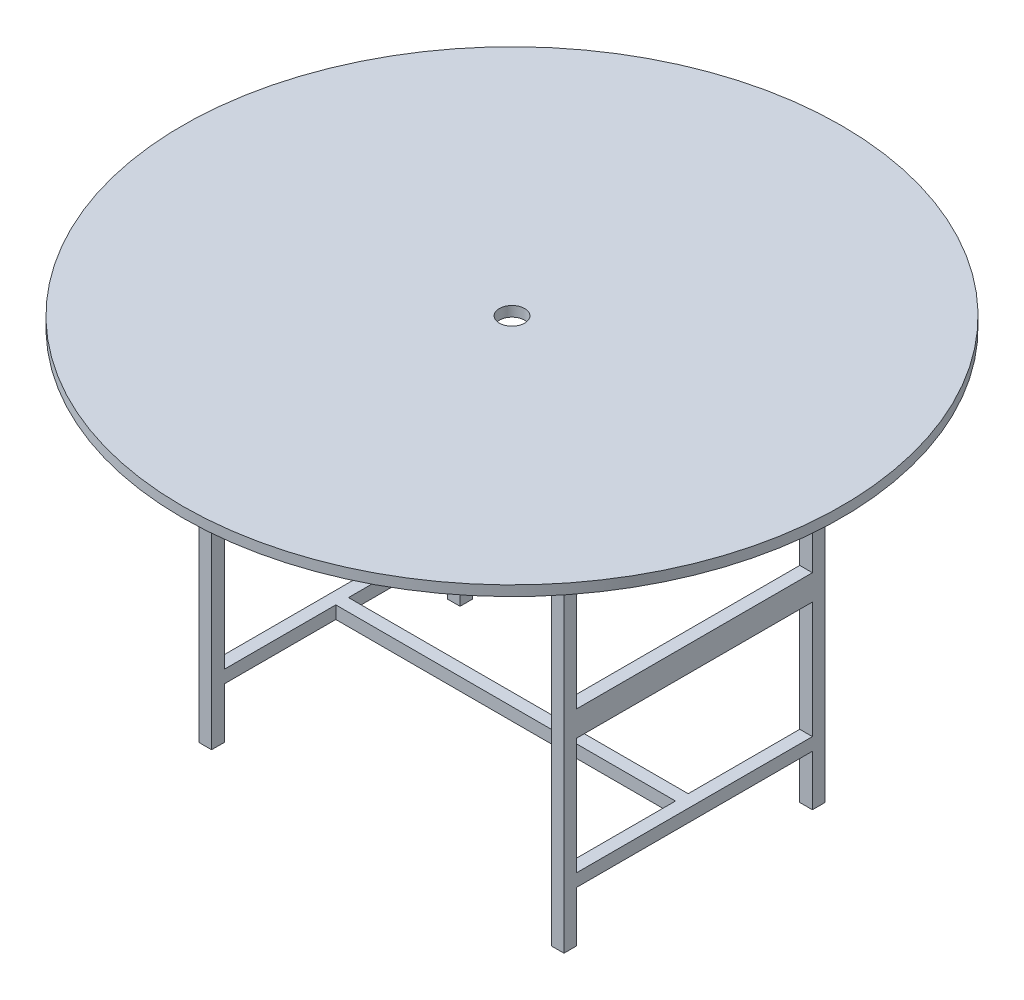
from build123d import *

# Parameters (mm, degrees)
SKETCH2_W             = 25
SKETCH2_H             = 25
BOSS_EXTRUDE1_DEPTH   = 760
BOSS_EXTRUDE1_2_DEPTH = 760
BOSS_EXTRUDE1_3_DEPTH = 760
BOSS_EXTRUDE1_4_DEPTH = 760
SKETCH3_W             = 25
SKETCH3_H             = 25
BOSS_EXTRUDE2_DEPTH   = 470
SKETCH6_W             = 25
SKETCH6_H             = 25
BOSS_EXTRUDE4_DEPTH   = 675
SKETCH10_W            = 25
SKETCH10_H            = 25
BOSS_EXTRUDE5_DEPTH   = 470
SKETCH11_W            = 25
SKETCH11_H            = 50
BOSS_EXTRUDE6_DEPTH   = 470
SKETCH12_R            = 650
BOSS_EXTRUDE7_DEPTH   = 20
SKETCH13_R            = 25
CUT_EXTRUDE3_DEPTH    = 20


with BuildPart() as part:
    # Sketch2 → Boss-Extrude1 (new body)
    with BuildSketch(Plane(origin=(0, 0, 0), x_dir=(1, 0, 0), z_dir=(0, 1, 0))):
        with Locations((-66.268467475, 428.678343046)):
            Rectangle(SKETCH2_W, SKETCH2_H)
    extrude(amount=-BOSS_EXTRUDE1_DEPTH)



with BuildPart() as body_2:
    # Sketch2 → Boss-Extrude1 2 (new body)
    with BuildSketch(Plane(origin=(0, 0, 0), x_dir=(1, 0, 0), z_dir=(0, 1, 0))):
        with Locations((628.731532525, 428.678343046)):
            Rectangle(SKETCH2_W, SKETCH2_H)
    extrude(amount=-BOSS_EXTRUDE1_2_DEPTH)


with BuildPart() as body_3:
    # Sketch2 → Boss-Extrude1 3 (new body)
    with BuildSketch(Plane(origin=(0, 0, 0), x_dir=(1, 0, 0), z_dir=(0, 1, 0))):
        with Locations((628.731532525, -61.321656954)):
            Rectangle(SKETCH2_W, SKETCH2_H)
    extrude(amount=-BOSS_EXTRUDE1_3_DEPTH)


with BuildPart() as body_4:
    # Sketch2 → Boss-Extrude1 4 (new body)
    with BuildSketch(Plane(origin=(0, 0, 0), x_dir=(1, 0, 0), z_dir=(0, 1, 0))):
        with Locations((-66.268467475, -61.321656954)):
            Rectangle(SKETCH2_W, SKETCH2_H)
    extrude(amount=-BOSS_EXTRUDE1_4_DEPTH)


with BuildPart() as part_1:
    add(part.part)

    add(body_2.part)  # Boss-Extrude2 merges body 2

    add(body_3.part)  # Boss-Extrude2 merges body 3

    add(body_4.part)  # Boss-Extrude2 merges body 4
    # Sketch3 → Boss-Extrude2 (add)
    with BuildSketch(Plane.XY.offset(-416.178343046)):
        with Locations((-66.268467475, -647.5)):
            Rectangle(SKETCH3_W, SKETCH3_H)
        with Locations((628.731532525, -647.5)):
            Rectangle(SKETCH3_W, SKETCH3_H)
    extrude(amount=BOSS_EXTRUDE2_DEPTH)

    # Sketch6 → Boss-Extrude4 (add)
    with BuildSketch(Plane(origin=(-53.768467475, 0, 0), x_dir=(0, 0, -1), z_dir=(1, 0, 0))):
        with Locations((428.678343046, -112.5)):
            Rectangle(SKETCH6_W, SKETCH6_H)
        with Locations((183.678343046, -647.5)):
            Rectangle(SKETCH6_W, SKETCH6_H)
        with Locations((-61.321656954, -112.5)):
            Rectangle(SKETCH6_W, SKETCH6_H)
    extrude(amount=BOSS_EXTRUDE4_DEPTH)

    # Sketch10 → Boss-Extrude5 (add)
    with BuildSketch(Plane(origin=(0, 0, 48.821656954), x_dir=(-1, 0, 0), z_dir=(0, 0, -1))):
        with Locations((-628.731532525, -112.5)):
            Rectangle(SKETCH10_W, SKETCH10_H)
        with Locations((66.268467475, -112.5)):
            Rectangle(SKETCH10_W, SKETCH10_H)
    extrude(amount=BOSS_EXTRUDE5_DEPTH)

    # Sketch11 → Boss-Extrude6 (add)
    with BuildSketch(Plane(origin=(0, 0, 48.821656954), x_dir=(-1, 0, 0), z_dir=(0, 0, -1))):
        with Locations((-628.731532525, -380.100970917)):
            Rectangle(SKETCH11_W, SKETCH11_H)
    extrude(amount=BOSS_EXTRUDE6_DEPTH)

    # Sketch12 → Boss-Extrude7 (add)
    with BuildSketch(Plane(origin=(0, 0, 0), x_dir=(1, 0, 0), z_dir=(0, 1, 0))):
        with Locations(Location((281.231532525, 183.678343046, 0), (0, 0, 270))):
            Circle(SKETCH12_R)
    extrude(amount=BOSS_EXTRUDE7_DEPTH)

    # Sketch13 → Cut-Extrude3 (cut)
    with BuildSketch(Plane(origin=(0, 0, 0), x_dir=(1, 0, 0), z_dir=(0, 1, 0))):
        with Locations(Location((281.231532525, 183.678343046, 0), (0, 0, 270))):
            Circle(SKETCH13_R)
    extrude(amount=CUT_EXTRUDE3_DEPTH, mode=Mode.SUBTRACT)


solid = part_1.part
